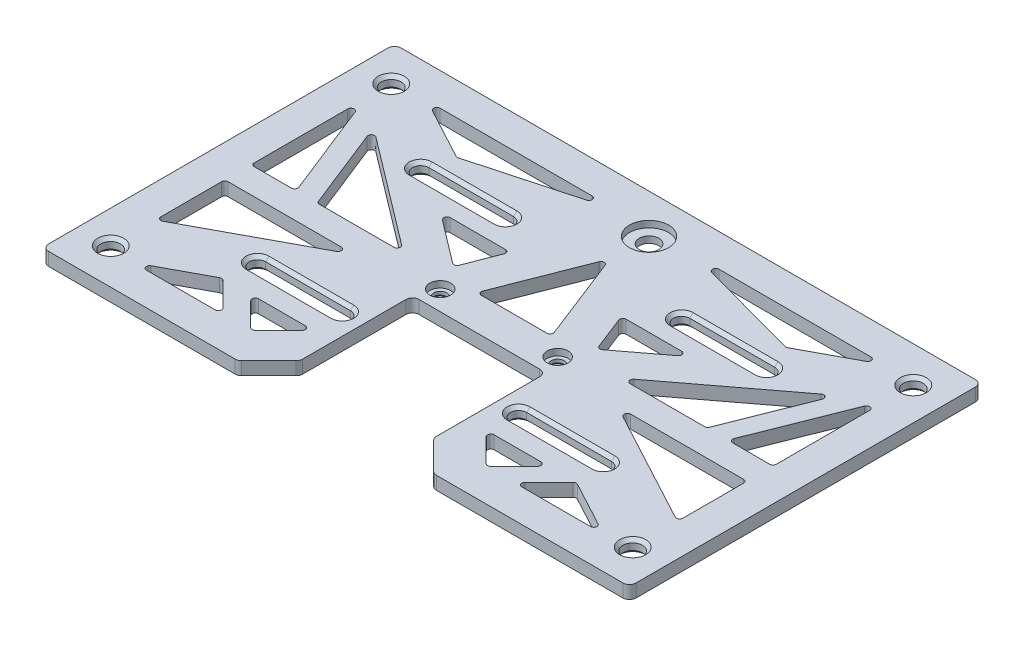
from build123d import *

# Parameters (mm, degrees)
SKETCH_1_R          = 1.5
SKETCH_1_R_2        = 1
EXTRUDE_1_DEPTH     = 2
SKETCH_3_R          = 1.6
SKETCH_3_R_2        = 3
CUT_EXTRUDE_2_DEPTH = 1
CUT_EXTRUDE_3_DEPTH = 2
FILLET_3_R          = 1
CHAMFER_2_SIZE      = 0.5
FILLET_4_R          = 0.5


with BuildPart() as part:
    # 草图1 → 凸台-拉伸1 (new body)
    with BuildSketch(Plane(origin=(0, 0, 0), x_dir=(1, 0, 0), z_dir=(0, 1, 0))):
        Polygon((-45, 26.899531218), (45, 26.899531218), (45, -27.100468782), (15, -27.100468782), (10.25, -22.350468782), (10.25, -5.100468782), (-10.25, -5.100468782), (-10.25, -22.350468782), (-15, -27.100468782), (-45, -27.100468782), align=None)
        with Locations(Location((-40, 21.399531218, 0), (0, 0, 270))):
            Circle(SKETCH_1_R, mode=Mode.SUBTRACT)
        with Locations(Location((-40, -21.600468782, 0), (0, 0, 270))):
            Circle(SKETCH_1_R, mode=Mode.SUBTRACT)
        with Locations(Location((40, 21.399531218, 0), (0, 0, 270))):
            Circle(SKETCH_1_R, mode=Mode.SUBTRACT)
        with Locations(Location((40, -21.600468782, 0), (0, 0, 270))):
            Circle(SKETCH_1_R, mode=Mode.SUBTRACT)
        with Locations(Location((-9, -2.100468782, 0), (0, 0, 270))):
            Circle(SKETCH_1_R_2, mode=Mode.SUBTRACT)
        with Locations(Location((9, -2.100468782, 0), (0, 0, 270))):
            Circle(SKETCH_1_R_2, mode=Mode.SUBTRACT)
        with Locations(Location((0, 20.899531218, 0), (0, 0, 270))):
            Circle(SKETCH_1_R, mode=Mode.SUBTRACT)
        with BuildLine():
            Line((-26.5, 13.649531218), (-13.5, 13.649531218))
            ThreePointArc((-13.5, 13.649531218), (-12.25, 12.399531218), (-13.5, 11.149531218))
            Line((-13.5, 11.149531218), (-26.5, 11.149531218))
            ThreePointArc((-26.5, 11.149531218), (-27.75, 12.399531218), (-26.5, 13.649531218))
        make_face(mode=Mode.SUBTRACT)
        with BuildLine():
            Line((-26.5, -11.350468782), (-13.5, -11.350468782))
            ThreePointArc((-13.5, -11.350468782), (-12.25, -12.600468782), (-13.5, -13.850468782))
            Line((-13.5, -13.850468782), (-26.5, -13.850468782))
            ThreePointArc((-26.5, -13.850468782), (-27.75, -12.600468782), (-26.5, -11.350468782))
        make_face(mode=Mode.SUBTRACT)
        with BuildLine():
            Line((13.5, 13.649531218), (26.5, 13.649531218))
            ThreePointArc((26.5, 13.649531218), (27.75, 12.399531218), (26.5, 11.149531218))
            Line((26.5, 11.149531218), (13.5, 11.149531218))
            ThreePointArc((13.5, 11.149531218), (12.25, 12.399531218), (13.5, 13.649531218))
        make_face(mode=Mode.SUBTRACT)
        with BuildLine():
            Line((13.5, -11.350468782), (26.5, -11.350468782))
            ThreePointArc((26.5, -11.350468782), (27.75, -12.600468782), (26.5, -13.850468782))
            Line((26.5, -13.850468782), (13.5, -13.850468782))
            ThreePointArc((13.5, -13.850468782), (12.25, -12.600468782), (13.5, -11.350468782))
        make_face(mode=Mode.SUBTRACT)
    extrude(amount=EXTRUDE_1_DEPTH)

    # 草图3 → 切除-拉伸2 (cut)
    with BuildSketch(Plane(origin=(0, 2, 0), x_dir=(1, 0, 0), z_dir=(0, 1, 0))):
        with Locations(Location((-9, -2.100468782, 0), (0, 0, 270))):
            Circle(SKETCH_3_R)
        with Locations(Location((9, -2.100468782, 0), (0, 0, 270))):
            Circle(SKETCH_3_R)
        with Locations(Location((0, 20.899531218, 0), (0, 0, 270))):
            Circle(SKETCH_3_R_2)
    extrude(amount=-CUT_EXTRUDE_2_DEPTH, mode=Mode.SUBTRACT)

    # 草图2 → 切除-拉伸3 (cut)
    with BuildSketch(Plane(origin=(0, 2, 0), x_dir=(1, 0, 0), z_dir=(0, 1, 0))):
        Polygon((-36, -22.100468782), (-22.28671569, -22.100468782), (-27.080790693, -17.306393779), align=None)
        Polygon((-18.044075003, -22.100468782), (-22.838150005, -17.306393779), (-13.25, -17.306393779), align=None)
        Polygon((-40, -14.747868465), (-20.190884311, -4.100468782), (-40, -4.100468782), align=None)
        Polygon((0, 14.899531218), (-5.74335042, 0.222080144), (5.74335042, 0.222080144), align=None)
        Polygon((-35, 21.899531218), (-6, 21.899531218), (-25.23255814, 16.649531218), align=None)
        Polygon((-29.849319142, -0.100468782), (-35.54355148, 14.240560811), (-16.625597549, -0.100468782), align=None)
        Polygon((-40, 17.334853501), (-40, -0.100468782), (-33.077151446, -0.100468782), align=None)
        Polygon((-19.210594542, 8.149531218), (-8.520261517, 8.149531218), (-10.965913691, 1.899531218), align=None)
        Polygon((22.838150005, -17.306393779), (13.25, -17.306393779), (18.044075003, -22.100468782), align=None)
        Polygon((22.28671569, -22.100468782), (27.080790693, -17.306393779), (36, -22.100468782), align=None)
        Polygon((20.190884311, -4.100468782), (40, -4.100468782), (40, -14.747868465), align=None)
        Polygon((8.520261517, 8.149531218), (10.965913691, 1.899531218), (19.210594542, 8.149531218), align=None)
        Polygon((35.54355148, 14.240560811), (16.625597549, -0.100468782), (29.849319142, -0.100468782), align=None)
        Polygon((40, -0.100468782), (33.077151446, -0.100468782), (40, 17.334853501), align=None)
        Polygon((6, 21.899531218), (25.23255814, 16.649531218), (35, 21.899531218), align=None)
    extrude(amount=-CUT_EXTRUDE_3_DEPTH, mode=Mode.SUBTRACT)

    # 圆角3
    fillet_3_edges = [part.edges().sort_by_distance(p)[0] for p in [
        (-45, 1, -26.899531218),
        (45, 1, -26.899531218),
        (45, 1, 27.100468782),
        (15, 1, 27.100468782),
        (10.25, 1, 22.350468782),
        (10.25, 1, 5.100468782),
        (-10.25, 1, 5.100468782),
        (-10.25, 1, 22.350468782),
        (-15, 1, 27.100468782),
        (-45, 1, 27.100468782),
    ]]
    fillet(fillet_3_edges, radius=FILLET_3_R)

    # 倒角2
    chamfer_2_edges = [part.edges().sort_by_distance(p)[0] for p in [
        (-27.75, 0, -12.399531218),
        (-20, 0, -11.149531218),
        (-12.25, 0, -12.399531218),
        (-20, 0, -13.649531218),
        (-27.75, 2, -12.399531218),
        (-20, 2, -11.149531218),
        (-12.25, 2, -12.399531218),
        (-20, 2, -13.649531218),
        (-27.75, 0, 12.600468782),
        (-20, 0, 13.850468782),
        (-12.25, 0, 12.600468782),
        (-20, 0, 11.350468782),
        (-27.75, 2, 12.600468782),
        (-20, 2, 13.850468782),
        (-12.25, 2, 12.600468782),
        (-20, 2, 11.350468782),
        (-9, 0, 1.100468782),
        (-40, 0, -22.899531218),
        (-40, 2, -22.899531218),
        (-40, 0, 20.100468782),
        (-40, 2, 20.100468782),
        (40, 0, -22.899531218),
        (40, 2, -22.899531218),
        (40, 0, 20.100468782),
        (40, 2, 20.100468782),
        (12.25, 0, -12.399531218),
        (20, 0, -11.149531218),
        (27.75, 0, -12.399531218),
        (20, 0, -13.649531218),
        (12.25, 2, -12.399531218),
        (20, 2, -11.149531218),
        (27.75, 2, -12.399531218),
        (20, 2, -13.649531218),
        (9, 0, 1.100468782),
        (12.25, 0, 12.600468782),
        (20, 0, 13.850468782),
        (27.75, 0, 12.600468782),
        (20, 0, 11.350468782),
        (12.25, 2, 12.600468782),
        (20, 2, 13.850468782),
        (27.75, 2, 12.600468782),
        (20, 2, 11.350468782),
    ]]
    chamfer(chamfer_2_edges, length=CHAMFER_2_SIZE)

    # 圆角4
    fillet_4_edges = [part.edges().sort_by_distance(p)[0] for p in [
        (-40, 1, -17.334853501),
        (-33.077151446, 1, 0.100468782),
        (-40, 1, 0.100468782),
        (-25.23255814, 1, -16.649531218),
        (-35, 1, -21.899531218),
        (-6, 1, -21.899531218),
        (-16.625597549, 1, 0.100468782),
        (-29.849319142, 1, 0.100468782),
        (-35.54355148, 1, -14.240560811),
        (22.838150005, 1, 17.306393779),
        (18.044075003, 1, 22.100468782),
        (13.25, 1, 17.306393779),
        (-13.25, 1, 17.306393779),
        (-18.044075003, 1, 22.100468782),
        (-22.838150005, 1, 17.306393779),
        (-10.965913691, 1, -1.899531218),
        (-19.210594542, 1, -8.149531218),
        (-8.520261517, 1, -8.149531218),
        (-40, 1, 14.747868465),
        (-40, 1, 4.100468782),
        (-20.190884311, 1, 4.100468782),
        (0, 1, -14.899531218),
        (5.74335042, 1, -0.222080144),
        (-5.74335042, 1, -0.222080144),
        (40, 1, -17.334853501),
        (40, 1, 0.100468782),
        (33.077151446, 1, 0.100468782),
        (6, 1, -21.899531218),
        (35, 1, -21.899531218),
        (25.23255814, 1, -16.649531218),
        (8.520261517, 1, -8.149531218),
        (19.210594542, 1, -8.149531218),
        (10.965913691, 1, -1.899531218),
        (35.54355148, 1, -14.240560811),
        (29.849319142, 1, 0.100468782),
        (16.625597549, 1, 0.100468782),
        (40, 1, 14.747868465),
        (20.190884311, 1, 4.100468782),
        (40, 1, 4.100468782),
        (36, 1, 22.100468782),
        (22.28671569, 1, 22.100468782),
        (27.080790693, 1, 17.306393779),
        (-36, 1, 22.100468782),
        (-27.080790693, 1, 17.306393779),
        (-22.28671569, 1, 22.100468782),
    ]]
    fillet(fillet_4_edges, radius=FILLET_4_R)


solid = part.part
